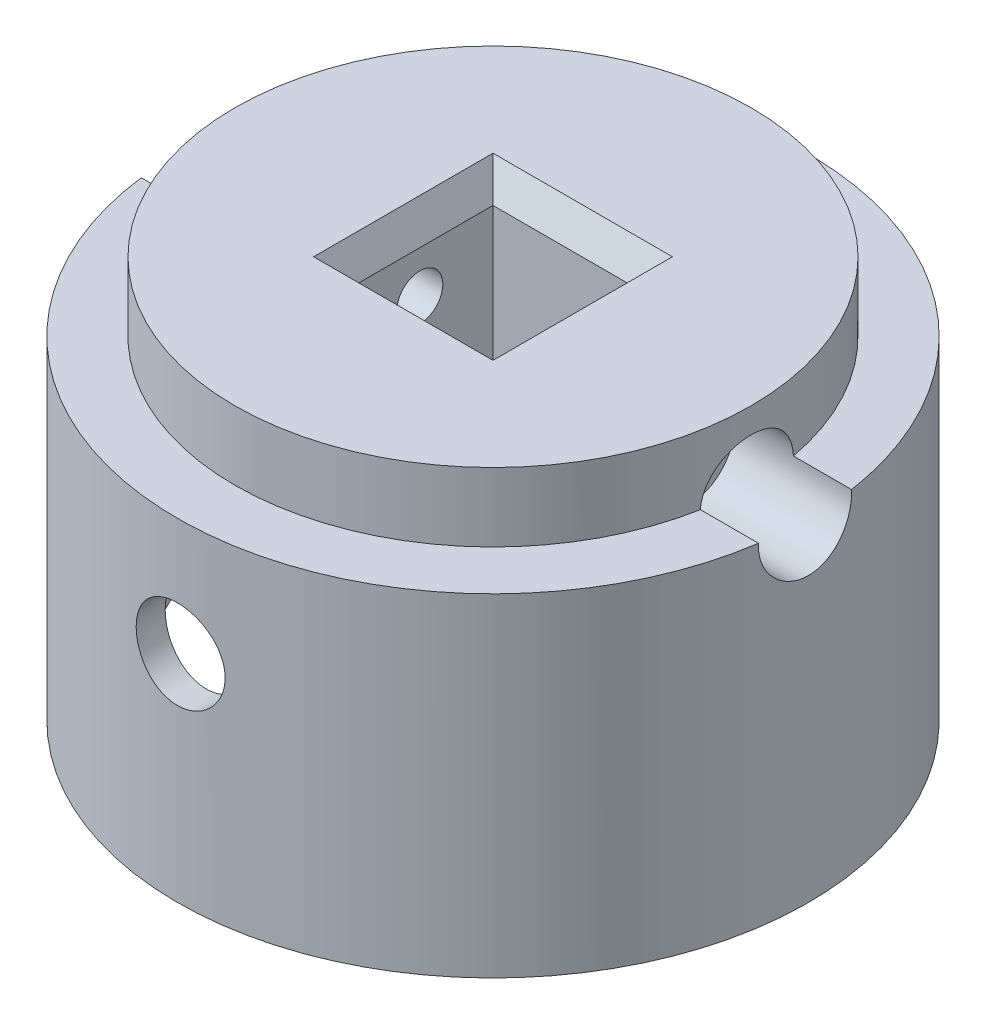
from build123d import *
from OCP.BRepFilletAPI import BRepFilletAPI_MakeChamfer

# Parameters (mm, degrees)
SKETCH1_R                = 22
BOSS_EXTRUDE1_DEPTH      = 28
SKETCH2_W                = 10.2
SKETCH2_H                = 10.2
CUT_EXTRUDE2_DEPTH       = 42.856899073
SHELL3_T                 = -2
SKETCH3_R                = 3.1
CUT_EXTRUDE3_DEPTH       = 46.987063398
CHAMFER1_SIZE            = 2
CHAMFER1_SIZE2           = 1.154700538
BOSS_EXTRUDE8_START      = 23
BOSS_EXTRUDE8_DEPTH      = 23
BOSS_EXTRUDE4_DEPTH      = 20
BOSS_EXTRUDE6_DEPTH      = 26
CUT_EXTRUDE5_DEPTH       = 10
SKETCH13_R               = 3.8
CUT_EXTRUDE6_DEPTH       = 16
SKETCH15_W               = 10
SKETCH15_H               = 3
CUT_EXTRUDE8_DEPTH       = 16
CUT_EXTRUDE9_DEPTH       = 2
BOSS_EXTRUDE10_START     = 7
BOSS_EXTRUDE10_DEPTH     = 7
SKETCH21_OUTSIDE_W       = 60
SKETCH21_OUTSIDE_H       = 62.694
SKETCH21_OUTSIDE_R       = 18
CUT_EXTRUDE11_DEPTH      = 4.8
CUT_EXTRUDE12_DEPTH      = 47.132512216
CUT_EXTRUDE12_DEPTH_BACK = 47.132512216
SKETCH22_R               = 1.6
CUT_EXTRUDE13_START      = -8.5
SKETCH24_R               = 3.25
CUT_EXTRUDE13_DEPTH      = 38.632512277
CUT_EXTRUDE14_START      = -8.5
CUT_EXTRUDE14_DEPTH      = 38.632512278


with BuildPart() as part:
    # Sketch1 → Boss-Extrude1 (new body)
    with BuildSketch(Plane(origin=(0, 0, 0), x_dir=(1, 0, 0), z_dir=(0, 1, 0))):
        with Locations(Location((0, 0, 0), (0, 0, 270))):
            Circle(SKETCH1_R)
    extrude(amount=BOSS_EXTRUDE1_DEPTH)

    # Sketch2 → Cut-Extrude2 (cut, through all)
    with BuildSketch(Plane.XZ):
        Rectangle(SKETCH2_W, SKETCH2_H)
    extrude(amount=-CUT_EXTRUDE2_DEPTH, mode=Mode.SUBTRACT)

    # Shell3
    shell3_openings = [part.faces().sort_by_distance(p)[0] for p in [
        (0, 0, -21.377746033),
    ]]
    offset(amount=SHELL3_T, openings=shell3_openings, kind=Kind.INTERSECTION)

    # Sketch3 → Cut-Extrude3 (cut, through all)
    with BuildSketch(Plane.XY.offset(7.1)):
        with Locations(Location((0, 15, 0), (0, 0, 90.000000051))):
            Circle(SKETCH3_R)
    extrude(amount=CUT_EXTRUDE3_DEPTH, mode=Mode.SUBTRACT)

    # Chamfer1: one chamfer whose edges measure the first distance from different faces: ONE call of the kernel's chamfer builder (chamfer() names one face for all edges)
    chamfer1_edges_1 = [part.edges().sort_by_distance(p)[0] for p in [
        (5.1, 28, 0),
    ]]
    chamfer1_side_1 = [part.faces().sort_by_distance(p)[0] for p in [
        (5.1, 14, 0),
    ]]
    chamfer1_edges_2 = [part.edges().sort_by_distance(p)[0] for p in [
        (0, 28, -5.1),
    ]]
    chamfer1_side_2 = [part.faces().sort_by_distance(p)[0] for p in [
        (0, 14, -5.1),
    ]]
    chamfer1_edges_3 = [part.edges().sort_by_distance(p)[0] for p in [
        (-5.1, 28, 0),
    ]]
    chamfer1_side_3 = [part.faces().sort_by_distance(p)[0] for p in [
        (-5.1, 14, 0),
    ]]
    chamfer1_edges_4 = [part.edges().sort_by_distance(p)[0] for p in [
        (0, 28, 5.1),
    ]]
    chamfer1_side_4 = [part.faces().sort_by_distance(p)[0] for p in [
        (0, 14, 5.1),
    ]]
    chamfer1 = BRepFilletAPI_MakeChamfer(part.part.solid().wrapped)
    for e in chamfer1_edges_1:
        chamfer1.Add(CHAMFER1_SIZE, CHAMFER1_SIZE2, e.wrapped, chamfer1_side_1[0].wrapped)  # the first distance lies on this face
    for e in chamfer1_edges_2:
        chamfer1.Add(CHAMFER1_SIZE, CHAMFER1_SIZE2, e.wrapped, chamfer1_side_2[0].wrapped)  # the first distance lies on this face
    for e in chamfer1_edges_3:
        chamfer1.Add(CHAMFER1_SIZE, CHAMFER1_SIZE2, e.wrapped, chamfer1_side_3[0].wrapped)  # the first distance lies on this face
    for e in chamfer1_edges_4:
        chamfer1.Add(CHAMFER1_SIZE, CHAMFER1_SIZE2, e.wrapped, chamfer1_side_4[0].wrapped)  # the first distance lies on this face
    add(Compound.cast(chamfer1.Shape()), mode=Mode.REPLACE)

    # Sketch18 → Boss-Extrude8 (add)
    with BuildSketch(Plane.XZ.offset(-26).offset(BOSS_EXTRUDE8_START)):
        with BuildLine():
            Line((-15.279498787, -7.452309495), (-17.975880926, -8.767422936))
            ThreePointArc((-17.975880926, -8.767422936), (-19.972590695, 1.046719125), (-16.960961923, 10.598385285))
            Line((-16.960961923, 10.598385285), (-14.416817635, 9.008627492))
            ThreePointArc((-14.416817635, 9.008627492), (-16.976702091, 0.889711256), (-15.279498787, -7.452309495))
        make_face()
    extrude(amount=-BOSS_EXTRUDE8_DEPTH)

    # Sketch9 → Boss-Extrude4 (add)
    with BuildSketch(Plane.XZ):
        Polygon((1.996845621, -21.909190025), (-16.569234798, -14.472748814), (-17.684700979, -17.257660876), (0.881379439, -24.694102088), align=None)
    extrude(amount=-BOSS_EXTRUDE4_DEPTH)

    # Sketch11 → Boss-Extrude6 (add)
    with BuildSketch(Plane.XZ):
        with BuildLine():
            Line((1.996845621, -21.909190025), (7.1, -7.1))
            Line((7.1, -7.1), (-7.1, -7.1))
            Line((-7.1, -7.1), (-16.569234798, -14.472748814))
            ThreePointArc((-16.569234798, -14.472748814), (-8.180085333, -20.42268846), (1.996845621, -21.909190025))
        make_face()
    extrude(amount=-BOSS_EXTRUDE6_DEPTH)

    # Sketch12 → Cut-Extrude5 (cut)
    with BuildSketch(Plane.XZ):
        with BuildLine():
            Line((3.837309235, -16.568223759), (2.718713258, -19.814353338))
            ThreePointArc((2.718713258, -19.814353338), (-6.959564044, -18.750052488), (-14.988393562, -13.241905393))
            Line((-14.988393562, -13.241905393), (-12.621280739, -11.398870699))
            ThreePointArc((-12.621280739, -11.398870699), (-5.096085911, -16.225316302), (3.837309235, -16.568223759))
        make_face()
    extrude(amount=-CUT_EXTRUDE5_DEPTH, mode=Mode.SUBTRACT)

    # Sketch13 → Cut-Extrude6 (cut)
    with BuildSketch(Plane(origin=(-8.40166077, 0, -20.975881482), x_dir=(-0.9283040209233338, 0, 0.3718220605848592), z_dir=(-0.3718220605848592, 0, -0.9283040209233338))):
        with Locations((0, 10)):
            Circle(SKETCH13_R)
    extrude(amount=-CUT_EXTRUDE6_DEPTH, mode=Mode.SUBTRACT)

    # Sketch15 → Cut-Extrude8 (cut)
    with BuildSketch(Plane(origin=(-8.40166077, 0, -20.975881482), x_dir=(-0.9283040209233339, 0, 0.37182206058485906), z_dir=(-0.37182206058485906, 0, -0.9283040209233339))):
        with Locations((0, 10)):
            Rectangle(SKETCH15_W, SKETCH15_H)
    extrude(amount=-CUT_EXTRUDE8_DEPTH, mode=Mode.SUBTRACT)

    # Sketch17 → Cut-Extrude9 (cut)
    with BuildSketch(Plane.XZ):
        with BuildLine():
            Line((7.1, 7.1), (7.1, -7.1))
            Line((7.1, -7.1), (3.837309235, -16.568223759))
            ThreePointArc((3.837309235, -16.568223759), (-5.096085911, -16.225316302), (-12.621280739, -11.398870699))
            Line((-12.621280739, -11.398870699), (-7.1, -7.1))
            Line((-7.1, -7.1), (-7.1, 7.1))
            Line((-7.1, 7.1), (7.1, 7.1))
        make_face()
    extrude(amount=-CUT_EXTRUDE9_DEPTH, mode=Mode.SUBTRACT)

    # Sketch20 → Boss-Extrude10 (add)
    with BuildSketch(Plane.XZ.offset(-26).offset(BOSS_EXTRUDE10_START)):
        with BuildLine():
            Line((2.718713258, -19.814353338), (7.1, -7.1))
            Line((7.1, -7.1), (7.1, 7.1))
            Line((7.1, 7.1), (-7.1, 7.1))
            Line((-7.1, 7.1), (-7.1, -7.1))
            Line((-7.1, -7.1), (-14.988393562, -13.241905393))
            ThreePointArc((-14.988393562, -13.241905393), (6.959564044, 18.750052488), (2.718713258, -19.814353338))
        make_face()
    extrude(amount=-BOSS_EXTRUDE10_DEPTH)

    # Sketch21 outside → Cut-Extrude11 (cut)
    with BuildSketch(Plane(origin=(0, 28, 0), x_dir=(1, 0, 0), z_dir=(0, 1, 0))):
        with Locations((0, 1.347)):
            Rectangle(SKETCH21_OUTSIDE_W, SKETCH21_OUTSIDE_H)
        with Locations(Location((0, 0, 0), (0, 0, 270))):
            Circle(SKETCH21_OUTSIDE_R, mode=Mode.SUBTRACT)
    extrude(amount=-CUT_EXTRUDE11_DEPTH, mode=Mode.SUBTRACT)

    # Sketch22 → Cut-Extrude12 (cut, two sides: drawn at the far end of the back side and taken through both)
    with BuildSketch(Plane.ZY.offset(-5.1).offset(-CUT_EXTRUDE12_DEPTH_BACK)):
        with Locations((0, 23)):
            Circle(SKETCH22_R)
    extrude(amount=CUT_EXTRUDE12_DEPTH + CUT_EXTRUDE12_DEPTH_BACK, mode=Mode.SUBTRACT)

    # Sketch24 → Cut-Extrude13 (cut, through all)
    with BuildSketch(Plane.ZY.offset(-5.1).offset(CUT_EXTRUDE13_START)):
        with Locations((0, 23)):
            Circle(SKETCH24_R)
    extrude(amount=-CUT_EXTRUDE13_DEPTH, mode=Mode.SUBTRACT)

    # Sketch25 → Cut-Extrude14 (cut, through all)
    with BuildSketch(Plane(origin=(-5.1, 0, 0), x_dir=(0, 0, -1), z_dir=(1, 0, 0)).offset(CUT_EXTRUDE14_START)):
        Polygon((0, 19.893553151), (2.690261887, 21.446776575), (2.690261887, 24.553223425), (0, 26.106446849), (-2.690261887, 24.553223425), (-2.690261887, 21.446776575), align=None)
    extrude(amount=-CUT_EXTRUDE14_DEPTH, mode=Mode.SUBTRACT)


solid = part.part
